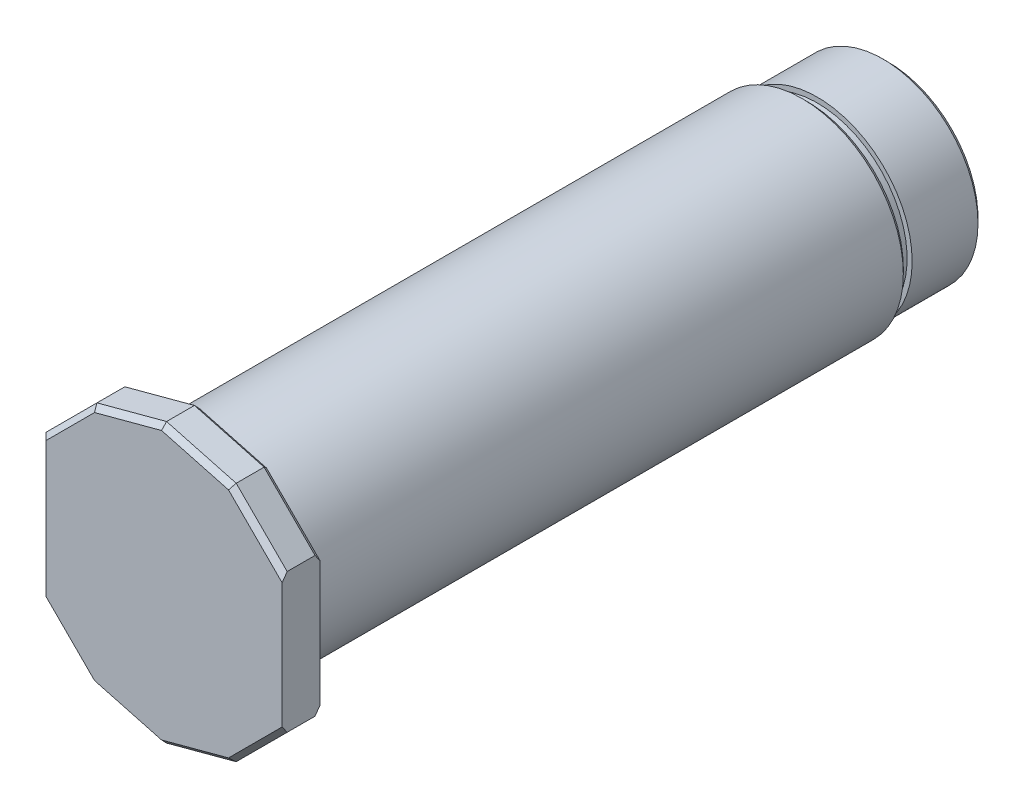
from build123d import *

# Parameters (mm, degrees)
EXTRUDE_1_DEPTH     = 15
CUT_EXTRUDE_1_DEPTH = 80.214897589
SKETCH_3_R          = 40
EXTRUDE_2_DEPTH     = 240
SKETCH_4_R          = 35.5
EXTRUDE_3_DEPTH     = 4
SKETCH_5_R          = 37.5
EXTRUDE_4_DEPTH     = 28
CHAMFER_1_SIZE      = 2


with BuildPart() as part:
    # 草图1 → 凸台-拉伸1 (new body)
    with BuildSketch(Plane.XY):
        Polygon((-27.5, 47.631397208), (-47.631397208, 27.5), (-55, 0), (-47.631397208, -27.5), (-27.5, -47.631397208), (0, -55), (27.5, -47.631397208), (47.631397208, -27.5), (55, 0), (47.631397208, 27.5), (27.5, 47.631397208), (0, 55), align=None)
    extrude(amount=EXTRUDE_1_DEPTH)

    # 草图2 → 切除-拉伸1 (cut, through all)
    with BuildSketch(Plane.XY.offset(15)):
        Polygon((-47.631397208, 27.5), (-47.631397208, -27.5), (-55, 0), align=None)
        Polygon((47.631397208, 27.5), (47.631397208, -27.5), (55, 0), align=None)
    extrude(amount=-CUT_EXTRUDE_1_DEPTH, mode=Mode.SUBTRACT)

    # 草图3 → 凸台-拉伸2 (add)
    with BuildSketch(Plane(origin=(0, 0, 0), x_dir=(-1, 0, 0), z_dir=(0, 0, -1))):
        with Locations(Location((0, 0, 0), (0, 0, 180))):
            Circle(SKETCH_3_R)
    extrude(amount=EXTRUDE_2_DEPTH)

    # 草图4 → 凸台-拉伸3 (add)
    with BuildSketch(Plane(origin=(0, 0, -240), x_dir=(-1, 0, 0), z_dir=(0, 0, -1))):
        Circle(SKETCH_4_R)
    extrude(amount=EXTRUDE_3_DEPTH)

    # 草图5 → 凸台-拉伸4 (add)
    with BuildSketch(Plane(origin=(0, 0, -244), x_dir=(-1, 0, 0), z_dir=(0, 0, -1))):
        Circle(SKETCH_5_R)
    extrude(amount=EXTRUDE_4_DEPTH)

    # 倒角1
    chamfer_1_edges = [part.edges().sort_by_distance(p)[0] for p in [
        (13.75, 51.315698604, 0),
        (37.565698604, 37.565698604, 0),
        (37.565698604, -37.565698604, 0),
        (13.75, -51.315698604, 0),
        (-13.75, -51.315698604, 0),
        (-37.565698604, -37.565698604, 0),
        (-37.565698604, 37.565698604, 0),
        (-13.75, 51.315698604, 0),
        (-37.565698604, -37.565698604, 15),
        (-13.75, -51.315698604, 15),
        (13.75, -51.315698604, 15),
        (37.565698604, -37.565698604, 15),
        (37.565698604, 37.565698604, 15),
        (-47.631397208, 0, 0),
        (13.75, 51.315698604, 15),
        (-47.631397208, 0, 15),
        (-13.75, 51.315698604, 15),
        (-40, 0, -240),
        (37.5, 0, -272),
        (-37.565698604, 37.565698604, 15),
    ]]
    chamfer(chamfer_1_edges, length=CHAMFER_1_SIZE)


solid = part.part
